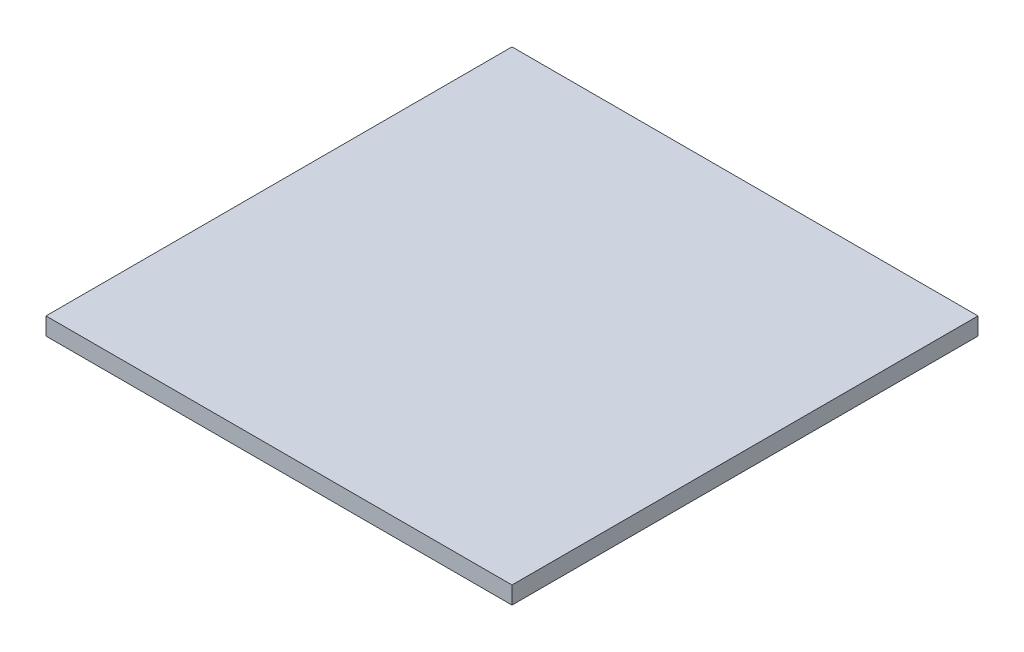
from build123d import *

# Parameters (mm, degrees)
SKETCH_1_W      = 400
SKETCH_1_H      = 400
EXTRUDE_1_DEPTH = 15


with BuildPart() as part:
    # Эскиз1 → Бобышка-Вытянуть1 (new body)
    with BuildSketch(Plane(origin=(0, 0, 0), x_dir=(1, 0, 0), z_dir=(0, 1, 0))):
        with Locations((200, 200)):
            Rectangle(SKETCH_1_W, SKETCH_1_H)
    extrude(amount=EXTRUDE_1_DEPTH)


solid = part.part
